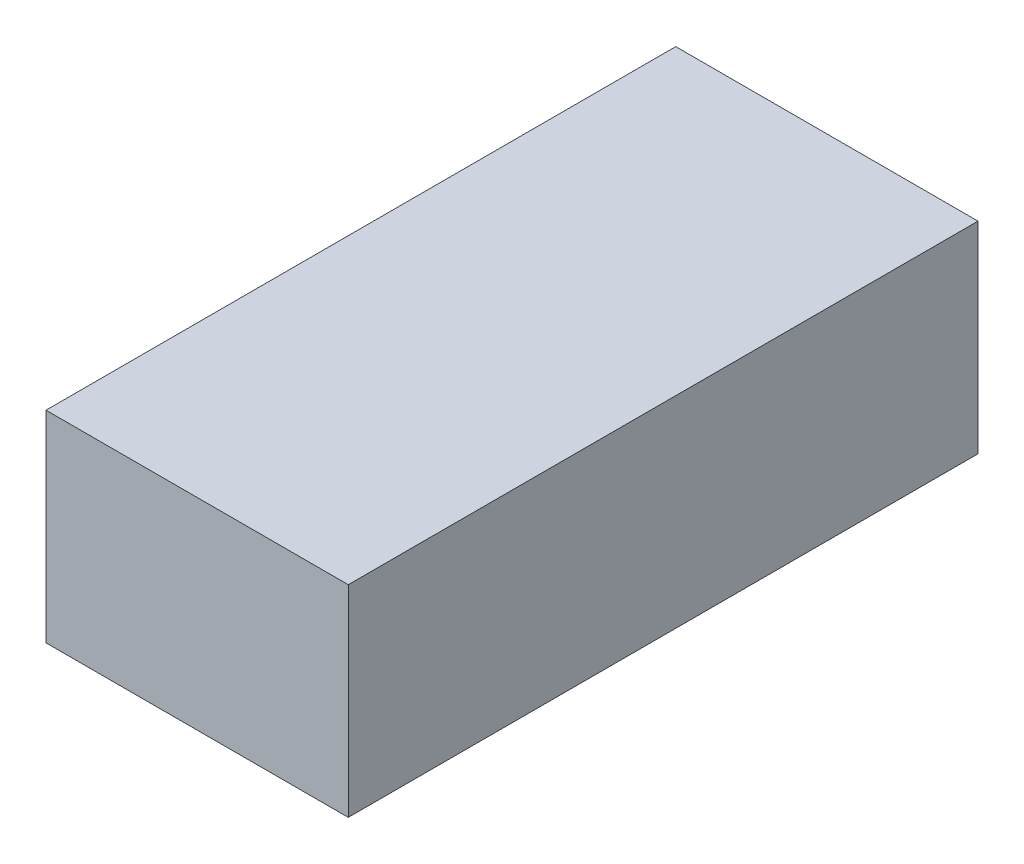
from build123d import *

# Parameters (mm, degrees)
SKETCH1_W           = 9.525
SKETCH1_H           = 19.84375
BOSS_EXTRUDE1_DEPTH = 6.35


with BuildPart() as part:
    # Sketch1 → Boss-Extrude1 (new body)
    with BuildSketch(Plane(origin=(0, 0, 0), x_dir=(1, 0, 0), z_dir=(0, 1, 0))):
        Rectangle(SKETCH1_W, SKETCH1_H)
    extrude(amount=BOSS_EXTRUDE1_DEPTH)


solid = part.part
